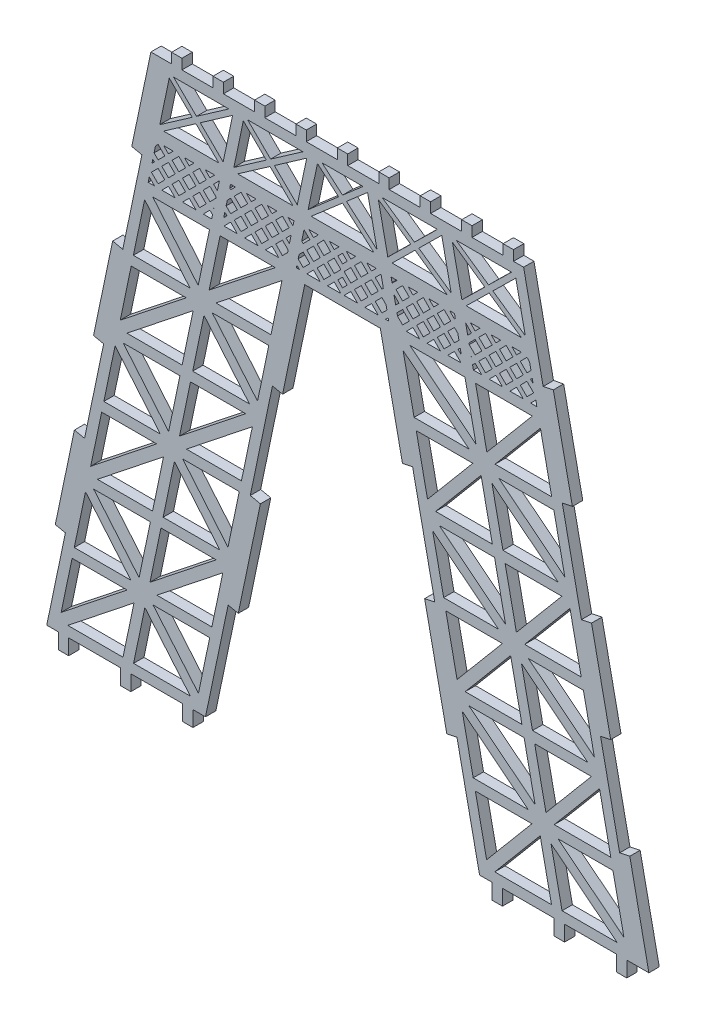
from build123d import *

# Parameters (mm, degrees)
BOSS_EXTRUDE1_DEPTH = 3


with BuildPart() as part:
    # Sketch1 → Boss-Extrude1 (new body)
    with BuildSketch(Plane.XY):
        Polygon((471.399547202, 122.11303907), (471.399547202, 117.61303907), (468.399547202, 117.61303907), (468.399547202, 122.11303907), (453.399547202, 122.11303907), (453.399547202, 117.61303907), (450.399547202, 117.61303907), (450.399547202, 122.11303907), (435.399547202, 122.11303907), (435.399547202, 117.61303907), (432.399547202, 117.61303907), (432.399547202, 122.11303907), (428.773422996, 122.11303907), (422.226309085, 153.416301309), (419.289848237, 152.802137088), (412.87118749, 183.491235105), (415.807648338, 184.105399326), (409.388987592, 214.794497344), (406.452526744, 214.180333123), (400.033865997, 244.86943114), (378.15395516, 244.86943114), (371.735294414, 214.180333123), (368.798833566, 214.794497344), (362.38017282, 184.105399326), (365.316633667, 183.491235105), (358.897972921, 152.802137088), (355.961512073, 153.416301309), (349.414398161, 122.11303907), (345.788273956, 122.11303907), (345.788273956, 117.61303907), (342.788273956, 117.61303907), (342.788273956, 122.11303907), (327.788273956, 122.11303907), (327.788273956, 117.61303907), (324.788273956, 117.61303907), (324.788273956, 122.11303907), (309.788273956, 122.11303907), (309.788273956, 117.61303907), (306.788273956, 117.61303907), (306.788273956, 122.11303907), (303.440687969, 122.11303907), (308.848590908, 147.969470794), (305.91213006, 148.583635015), (311.448486164, 175.05423096), (314.384947011, 174.440066739), (319.921303115, 200.910662683), (316.984842267, 201.524826904), (322.521198371, 227.995422849), (325.457659219, 227.381258628), (330.994015323, 253.851854573), (328.057554475, 254.466018794), (333.593910579, 280.936614739), (339.593910579, 280.936614739), (339.593910579, 283.86943114), (342.593910579, 283.86943114), (342.593910579, 280.936614739), (351.593910579, 280.936614739), (351.593910579, 283.86943114), (354.593910579, 283.86943114), (354.593910579, 280.936614739), (363.593910579, 280.936614739), (363.593910579, 283.86943114), (366.593910579, 283.86943114), (366.593910579, 280.936614739), (375.593910579, 280.936614739), (375.593910579, 283.86943114), (378.593910579, 283.86943114), (378.593910579, 280.936614739), (387.593910579, 280.936614739), (387.593910579, 283.86943114), (390.593910579, 283.86943114), (390.593910579, 280.936614739), (399.593910579, 280.936614739), (399.593910579, 283.86943114), (402.593910579, 283.86943114), (402.593910579, 280.936614739), (411.593910579, 280.936614739), (411.593910579, 283.86943114), (414.593910579, 283.86943114), (414.593910579, 280.936614739), (423.593910579, 280.936614739), (423.593910579, 283.86943114), (426.593910579, 283.86943114), (426.593910579, 280.936614739), (435.593910579, 280.936614739), (435.593910579, 283.86943114), (438.593910579, 283.86943114), (438.593910579, 280.936614739), (441.528996566, 280.936614739), (447.193805835, 253.851854573), (450.130266683, 254.466018794), (455.666622786, 227.995422849), (452.730161939, 227.381258628), (458.266518043, 200.910662683), (461.20297889, 201.524826904), (466.739334994, 175.05423096), (463.802874146, 174.440066739), (469.33923025, 147.969470794), (472.275691098, 148.583635015), (477.812047202, 122.11303907), align=None)
        Polygon((350.454551529, 229.664679794), (353.634643058, 244.86943114), (369.611318566, 244.86943114), align=None, mode=Mode.SUBTRACT)
        Polygon((371.543867516, 242.573199091), (368.372473479, 227.410032462), (352.439493887, 227.410032462), align=None, mode=Mode.SUBTRACT)
        Polygon((327.901137804, 224.410032462), (324.729743767, 209.246865833), (343.834117396, 224.410032462), align=None, mode=Mode.SUBTRACT)
        Polygon((326.662292717, 206.950633784), (345.819059754, 222.15538513), (342.638968225, 206.950633784), align=None, mode=Mode.SUBTRACT)
        Polygon((341.8963372, 188.745882437), (345.076428729, 203.950633784), (361.053104237, 203.950633784), align=None, mode=Mode.SUBTRACT)
        Polygon((362.985653187, 201.654401734), (359.814259151, 186.491235105), (343.881279558, 186.491235105), align=None, mode=Mode.SUBTRACT)
        Polygon((319.342923475, 183.491235105), (316.171529438, 168.328068476), (335.275903067, 183.491235105), align=None, mode=Mode.SUBTRACT)
        Polygon((318.104078389, 166.031836427), (337.260845425, 181.236587773), (334.080753896, 166.031836427), align=None, mode=Mode.SUBTRACT)
        Polygon((333.338122872, 147.827085081), (336.5182144, 163.031836427), (352.494889908, 163.031836427), align=None, mode=Mode.SUBTRACT)
        Polygon((354.427438858, 160.735604378), (351.256044822, 145.572437748), (335.32306523, 145.572437748), align=None, mode=Mode.SUBTRACT)
        Polygon((310.784709146, 142.572437748), (307.61331511, 127.409271119), (326.717688738, 142.572437748), align=None, mode=Mode.SUBTRACT)
        Polygon((309.54586406, 125.11303907), (328.702631096, 140.317790416), (325.522539568, 125.11303907), align=None, mode=Mode.SUBTRACT)
        Polygon((345.01639696, 125.11303907), (328.587453581, 125.11303907), (331.857567168, 140.748206652), align=None, mode=Mode.SUBTRACT)
        Polygon((347.367175217, 126.978854884), (350.628591313, 142.572437748), (334.243343849, 142.572437748), align=None, mode=Mode.SUBTRACT)
        Polygon((317.024357008, 163.031836427), (333.453300387, 163.031836427), (330.1831868, 147.396668845), align=None, mode=Mode.SUBTRACT)
        Polygon((314.673578751, 161.166020613), (311.412162655, 145.572437748), (327.797410119, 145.572437748), align=None, mode=Mode.SUBTRACT)
        Polygon((353.574611288, 166.031836427), (337.145667909, 166.031836427), (340.415781497, 181.667004008), align=None, mode=Mode.SUBTRACT)
        Polygon((355.925389546, 167.897652241), (342.801558178, 183.491235105), (359.186805642, 183.491235105), align=None, mode=Mode.SUBTRACT)
        Polygon((325.582571337, 203.950633784), (342.011514716, 203.950633784), (338.741401129, 188.315466202), align=None, mode=Mode.SUBTRACT)
        Polygon((323.231793079, 202.08481797), (319.970376984, 186.491235105), (336.355624447, 186.491235105), align=None, mode=Mode.SUBTRACT)
        Polygon((362.132825617, 206.950633784), (345.703882238, 206.950633784), (348.973995826, 222.585801365), align=None, mode=Mode.SUBTRACT)
        Polygon((364.483603875, 208.816449598), (351.359772507, 224.410032462), (367.74501997, 224.410032462), align=None, mode=Mode.SUBTRACT)
        Polygon((334.140785666, 244.86943114), (350.569729045, 244.86943114), (347.299615457, 229.234263559), align=None, mode=Mode.SUBTRACT)
        Polygon((331.790007408, 243.003615326), (328.528591313, 227.410032462), (344.913838776, 227.410032462), align=None, mode=Mode.SUBTRACT)
        Polygon((347.892471052, 270.337812889), (357.261962632, 276.866544031), (354.530979123, 263.809081747), align=None, mode=Mode.SUBTRACT)
        Polygon((338.9138076, 277.06414773), (345.552315671, 270.535416588), (336.18282409, 264.006685446), align=None, mode=Mode.SUBTRACT)
        Polygon((353.278887083, 262.936614739), (337.270887433, 262.936614739), (346.640379013, 269.465345881), align=None, mode=Mode.SUBTRACT)
        Polygon((340.16589964, 277.936614739), (356.17389929, 277.936614739), (346.80440771, 271.407883597), align=None, mode=Mode.SUBTRACT)
        Polygon((367.00671376, 270.535416588), (357.63722218, 264.006685446), (360.36820569, 277.06414773), align=None, mode=Mode.SUBTRACT)
        Polygon((374.733285173, 262.936614739), (358.725285523, 262.936614739), (368.094777103, 269.465345881), align=None, mode=Mode.SUBTRACT)
        Polygon((369.346869142, 270.337812889), (378.716360722, 276.866544031), (375.985377212, 263.809081747), align=None, mode=Mode.SUBTRACT)
        Polygon((361.620297729, 277.936614739), (377.62829738, 277.936614739), (368.2588058, 271.407883597), align=None, mode=Mode.SUBTRACT)
        Polygon((387.948477617, 271.795529376), (379.121277983, 264.148485817), (381.829377401, 277.096533979), align=None, mode=Mode.SUBTRACT)
        Polygon((379.315024438, 259.306374211), (382.067590235, 259.306374211), (380.691307336, 257.930091312), align=None, mode=Mode.SUBTRACT)
        Polygon((386.691307336, 257.930091312), (385.315024438, 259.306374211), (388.067590235, 259.306374211), align=None, mode=Mode.SUBTRACT)
        Polygon((386.691307336, 255.808770969), (388.630647165, 253.86943114), (386.691307336, 251.930091312), (384.751967508, 253.86943114), align=None, mode=Mode.SUBTRACT)
        Polygon((385.630647165, 256.86943114), (383.691307336, 254.930091312), (381.751967508, 256.86943114), (383.691307336, 258.808770969), align=None, mode=Mode.SUBTRACT)
        Polygon((384.751967508, 247.86943114), (386.691307336, 249.808770969), (388.630647165, 247.86943114), align=None, mode=Mode.SUBTRACT)
        Polygon((381.751967508, 250.86943114), (383.691307336, 252.808770969), (385.630647165, 250.86943114), (383.691307336, 248.930091312), align=None, mode=Mode.SUBTRACT)
        Polygon((378.751967508, 253.86943114), (380.691307336, 255.808770969), (382.630647165, 253.86943114), (380.691307336, 251.930091312), align=None, mode=Mode.SUBTRACT)
        Polygon((373.315024438, 259.306374211), (375.043630664, 259.306374211), (374.772830059, 258.011614035), (374.691307336, 257.930091312), align=None, mode=Mode.SUBTRACT)
        Polygon((377.279392467, 255.342006182), (377.950301454, 258.549776851), (379.630647165, 256.86943114), (377.691307336, 254.930091312), align=None, mode=Mode.SUBTRACT)
        Polygon((376.630647165, 247.86943114), (375.716494657, 247.86943114), (375.874618861, 248.625459444), align=None, mode=Mode.SUBTRACT)
        Polygon((378.751967508, 247.86943114), (380.691307336, 249.808770969), (382.630647165, 247.86943114), align=None, mode=Mode.SUBTRACT)
        Polygon((376.24155117, 250.379847479), (376.500505831, 251.617969464), (377.691307336, 252.808770969), (379.630647165, 250.86943114), (377.691307336, 248.930091312), align=None, mode=Mode.SUBTRACT)
        Polygon((372.751967508, 253.86943114), (374.211816862, 255.329280494), (373.706786213, 252.914612436), align=None, mode=Mode.SUBTRACT)
        Polygon((369.751967508, 256.86943114), (371.691307336, 258.808770969), (373.630647165, 256.86943114), (371.691307336, 254.930091312), align=None, mode=Mode.SUBTRACT)
        Polygon((367.315024438, 259.306374211), (370.067590235, 259.306374211), (368.691307336, 257.930091312), align=None, mode=Mode.SUBTRACT)
        Polygon((369.751967508, 250.86943114), (371.691307337, 252.808770969), (373.339853904, 251.160224402), (373.186045114, 250.42482909), (371.691307336, 248.930091312), align=None, mode=Mode.SUBTRACT)
        Polygon((366.751967508, 253.86943114), (368.691307336, 255.808770969), (370.630647165, 253.86943114), (368.691307336, 251.930091312), align=None, mode=Mode.SUBTRACT)
        Polygon((363.751967508, 256.86943114), (365.691307336, 258.808770969), (367.630647165, 256.86943114), (365.691307336, 254.930091312), align=None, mode=Mode.SUBTRACT)
        Polygon((361.315024438, 259.306374211), (364.067590235, 259.306374211), (362.691307336, 257.930091312), align=None, mode=Mode.SUBTRACT)
        Polygon((366.751967508, 247.86943114), (368.691307336, 249.808770969), (370.630647165, 247.86943114), align=None, mode=Mode.SUBTRACT)
        Polygon((363.751967508, 250.86943114), (365.691307336, 252.808770969), (367.630647165, 250.86943114), (365.691307336, 248.930091312), align=None, mode=Mode.SUBTRACT)
        Polygon((360.751967508, 253.86943114), (362.691307336, 255.808770969), (364.630647165, 253.86943114), (362.691307336, 251.930091312), align=None, mode=Mode.SUBTRACT)
        Polygon((357.751967508, 256.86943114), (359.691307336, 258.808770969), (361.630647165, 256.86943114), (359.691307336, 254.930091312), align=None, mode=Mode.SUBTRACT)
        Polygon((356.422513876, 258.198884773), (356.654146588, 259.306374211), (358.067590235, 259.306374211), (356.691307337, 257.930091312), align=None, mode=Mode.SUBTRACT)
        Polygon((355.630647165, 250.86943114), (354.693556459, 249.932340434), (355.01774027, 251.482338035), align=None, mode=Mode.SUBTRACT)
        Polygon((360.751967508, 247.86943114), (362.691307336, 249.808770969), (364.630647165, 247.86943114), align=None, mode=Mode.SUBTRACT)
        Polygon((357.751967508, 250.86943114), (359.691307336, 252.808770969), (361.630647165, 250.86943114), (359.691307336, 248.930091312), align=None, mode=Mode.SUBTRACT)
        Polygon((355.384672579, 253.236726069), (355.719328206, 254.836791839), (356.691307336, 255.808770969), (358.630647165, 253.86943114), (356.691307336, 251.930091312), align=None, mode=Mode.SUBTRACT)
        Polygon((351.751967508, 256.86943114), (353.430639237, 258.548102869), (352.849907622, 255.771491027), align=None, mode=Mode.SUBTRACT)
        Polygon((349.315024438, 259.306374211), (352.067590235, 259.306374211), (350.691307336, 257.930091312), align=None, mode=Mode.SUBTRACT)
        Polygon((354.751967508, 247.86943114), (356.691307336, 249.808770969), (358.630647165, 247.86943114), align=None, mode=Mode.SUBTRACT)
        Polygon((351.751967508, 250.86943114), (351.843854291, 250.961317923), (351.812066325, 250.809332323), align=None, mode=Mode.SUBTRACT)
        Polygon((348.751967508, 253.86943114), (350.691307337, 255.808770969), (352.482975313, 254.017102992), (352.404867489, 253.643651464), (350.691307336, 251.930091312), align=None, mode=Mode.SUBTRACT)
        Polygon((345.751967508, 256.86943114), (347.691307336, 258.808770969), (349.630647165, 256.86943114), (347.691307336, 254.930091312), align=None, mode=Mode.SUBTRACT)
        Polygon((343.315024438, 259.306374211), (346.067590235, 259.306374211), (344.691307336, 257.930091312), align=None, mode=Mode.SUBTRACT)
        Polygon((348.751967508, 247.86943114), (350.691307336, 249.808770969), (351.445134016, 249.054944289), (351.197182554, 247.86943114), align=None, mode=Mode.SUBTRACT)
        Polygon((345.751967508, 250.86943114), (347.691307336, 252.808770969), (349.630647165, 250.86943114), (347.691307336, 248.930091312), align=None, mode=Mode.SUBTRACT)
        Polygon((342.751967508, 253.86943114), (344.691307336, 255.808770969), (346.630647165, 253.86943114), (344.691307336, 251.930091312), align=None, mode=Mode.SUBTRACT)
        Polygon((339.751967508, 256.86943114), (341.691307336, 258.808770969), (343.630647165, 256.86943114), (341.691307336, 254.930091312), align=None, mode=Mode.SUBTRACT)
        Polygon((337.315024438, 259.306374211), (340.067590235, 259.306374211), (338.691307336, 257.930091312), align=None, mode=Mode.SUBTRACT)
        Polygon((342.751967508, 247.86943114), (344.691307336, 249.808770969), (346.630647165, 247.86943114), align=None, mode=Mode.SUBTRACT)
        Polygon((339.751967508, 250.86943114), (341.691307336, 252.808770969), (343.630647165, 250.86943114), (341.691307336, 248.930091312), align=None, mode=Mode.SUBTRACT)
        Polygon((336.751967508, 253.86943114), (338.691307336, 255.808770969), (340.630647165, 253.86943114), (338.691307336, 251.930091312), align=None, mode=Mode.SUBTRACT)
        Polygon((334.527793988, 256.09360466), (334.938150581, 258.055614213), (335.691307336, 258.808770969), (337.630647165, 256.86943114), (335.691307336, 254.930091312), align=None, mode=Mode.SUBTRACT)
        Polygon((334.160861679, 254.339216626), (334.630647165, 253.86943114), (333.912378834, 253.151162809), align=None, mode=Mode.SUBTRACT)
        Polygon((336.751967508, 247.86943114), (338.691307337, 249.808770969), (340.630647165, 247.86943114), align=None, mode=Mode.SUBTRACT)
        Polygon((333.751967508, 250.86943114), (335.691307336, 252.808770969), (337.630647165, 250.86943114), (335.691307336, 248.930091312), align=None, mode=Mode.SUBTRACT)
        Polygon((332.807698477, 247.86943114), (334.630647165, 247.86943114), (333.123020382, 249.377057923), align=None, mode=Mode.SUBTRACT)
        Polygon((427.733269629, 229.664679794), (424.5531781, 244.86943114), (408.576502592, 244.86943114), align=None, mode=Mode.SUBTRACT)
        Polygon((425.748327271, 227.410032462), (409.815347678, 227.410032462), (406.643953642, 242.573199091), align=None, mode=Mode.SUBTRACT)
        Polygon((434.353703762, 224.410032462), (453.45807739, 209.246865833), (450.286683354, 224.410032462), align=None, mode=Mode.SUBTRACT)
        Polygon((451.52552844, 206.950633784), (432.368761404, 222.15538513), (435.548852932, 206.950633784), align=None, mode=Mode.SUBTRACT)
        Polygon((436.291483957, 188.745882437), (433.111392429, 203.950633784), (417.134716921, 203.950633784), align=None, mode=Mode.SUBTRACT)
        Polygon((434.306541599, 186.491235105), (418.373562007, 186.491235105), (415.202167971, 201.654401734), align=None, mode=Mode.SUBTRACT)
        Polygon((442.911918091, 183.491235105), (462.016291719, 168.328068476), (458.844897683, 183.491235105), align=None, mode=Mode.SUBTRACT)
        Polygon((460.083742769, 166.031836427), (440.926975733, 181.236587773), (444.107067261, 166.031836427), align=None, mode=Mode.SUBTRACT)
        Polygon((444.849698286, 147.827085081), (441.669606757, 163.031836427), (425.69293125, 163.031836427), align=None, mode=Mode.SUBTRACT)
        Polygon((442.864755928, 145.572437748), (426.931776336, 145.572437748), (423.760382299, 160.735604378), align=None, mode=Mode.SUBTRACT)
        Polygon((451.470132419, 142.572437748), (470.574506048, 127.409271119), (467.403112012, 142.572437748), align=None, mode=Mode.SUBTRACT)
        Polygon((468.641957098, 125.11303907), (449.485190061, 140.317790416), (452.66528159, 125.11303907), align=None, mode=Mode.SUBTRACT)
        Polygon((446.330253989, 140.748206652), (449.600367577, 125.11303907), (433.171424198, 125.11303907), align=None, mode=Mode.SUBTRACT)
        Polygon((443.944477308, 142.572437748), (427.559229845, 142.572437748), (430.82064594, 126.978854884), align=None, mode=Mode.SUBTRACT)
        Polygon((461.163464149, 163.031836427), (444.73452077, 163.031836427), (448.004634358, 147.396668845), align=None, mode=Mode.SUBTRACT)
        Polygon((450.390411039, 145.572437748), (466.775658503, 145.572437748), (463.514242407, 161.166020613), align=None, mode=Mode.SUBTRACT)
        Polygon((424.613209869, 166.031836427), (441.042153248, 166.031836427), (437.772039661, 181.667004008), align=None, mode=Mode.SUBTRACT)
        Polygon((422.262431612, 167.897652241), (435.38626298, 183.491235105), (419.001015516, 183.491235105), align=None, mode=Mode.SUBTRACT)
        Polygon((452.60524982, 203.950633784), (436.176306441, 203.950633784), (439.446420029, 188.315466202), align=None, mode=Mode.SUBTRACT)
        Polygon((441.83219671, 186.491235105), (458.217444174, 186.491235105), (454.956028078, 202.08481797), align=None, mode=Mode.SUBTRACT)
        Polygon((416.054995541, 206.950633784), (432.48393892, 206.950633784), (429.213825332, 222.585801365), align=None, mode=Mode.SUBTRACT)
        Polygon((413.704217283, 208.816449598), (426.828048651, 224.410032462), (410.442801187, 224.410032462), align=None, mode=Mode.SUBTRACT)
        Polygon((444.047035492, 244.86943114), (427.618092113, 244.86943114), (430.8882057, 229.234263559), align=None, mode=Mode.SUBTRACT)
        Polygon((433.273982381, 227.410032462), (449.659229845, 227.410032462), (446.397813749, 243.003615326), align=None, mode=Mode.SUBTRACT)
        Polygon((430.295350105, 270.337812889), (420.925858525, 276.866544031), (423.656842035, 263.809081747), align=None, mode=Mode.SUBTRACT)
        Polygon((439.274013558, 277.06414773), (432.635505487, 270.535416588), (442.004997067, 264.006685446), align=None, mode=Mode.SUBTRACT)
        Polygon((424.908934074, 262.936614739), (440.916933725, 262.936614739), (431.547442145, 269.465345881), align=None, mode=Mode.SUBTRACT)
        Polygon((431.383413448, 271.407883597), (422.013921868, 277.936614739), (438.021921518, 277.936614739), align=None, mode=Mode.SUBTRACT)
        Polygon((411.181107397, 270.535416588), (420.550598977, 264.006685446), (417.819615468, 277.06414773), align=None, mode=Mode.SUBTRACT)
        Polygon((403.454535985, 262.936614739), (419.462535635, 262.936614739), (410.093044055, 269.465345881), align=None, mode=Mode.SUBTRACT)
        Polygon((408.840952016, 270.337812889), (399.471460436, 276.866544031), (402.202443945, 263.809081747), align=None, mode=Mode.SUBTRACT)
        Polygon((409.929015358, 271.407883597), (400.559523778, 277.936614739), (416.567523428, 277.936614739), align=None, mode=Mode.SUBTRACT)
        Polygon((390.23934354, 271.795529376), (399.066543174, 264.148485817), (396.358443756, 277.096533979), align=None, mode=Mode.SUBTRACT)
        Polygon((398.87279672, 259.306374211), (396.120230922, 259.306374211), (397.496513821, 257.930091312), align=None, mode=Mode.SUBTRACT)
        Polygon((390.435853649, 250.86943114), (389.093910579, 252.211374211), (387.751967508, 250.86943114), (389.093910579, 249.52748807), align=None, mode=Mode.SUBTRACT)
        Polygon((391.496513821, 257.930091312), (392.87279672, 259.306374211), (390.120230922, 259.306374211), align=None, mode=Mode.SUBTRACT)
        Polygon((391.496513821, 255.808770969), (389.557173993, 253.86943114), (391.496513821, 251.930091312), (393.435853649, 253.86943114), align=None, mode=Mode.SUBTRACT)
        Polygon((392.557173993, 256.86943114), (394.496513821, 254.930091312), (396.435853649, 256.86943114), (394.496513821, 258.808770969), align=None, mode=Mode.SUBTRACT)
        Polygon((393.435853649, 247.86943114), (391.496513821, 249.808770969), (389.557173993, 247.86943114), align=None, mode=Mode.SUBTRACT)
        Polygon((396.435853649, 250.86943114), (394.496513821, 252.808770969), (392.557173993, 250.86943114), (394.496513821, 248.930091312), align=None, mode=Mode.SUBTRACT)
        Polygon((399.435853649, 253.86943114), (397.496513821, 255.808770969), (395.557173993, 253.86943114), (397.496513821, 251.930091312), align=None, mode=Mode.SUBTRACT)
        Polygon((404.87279672, 259.306374211), (403.144190493, 259.306374211), (403.414991099, 258.011614035), (403.496513821, 257.930091312), align=None, mode=Mode.SUBTRACT)
        Polygon((400.908428691, 255.342006182), (400.237519703, 258.549776851), (398.557173993, 256.86943114), (400.496513821, 254.930091312), align=None, mode=Mode.SUBTRACT)
        Polygon((402.313202297, 248.625459444), (402.471326501, 247.86943114), (401.557173993, 247.86943114), align=None, mode=Mode.SUBTRACT)
        Polygon((399.435853649, 247.86943114), (397.496513821, 249.808770969), (395.557173993, 247.86943114), align=None, mode=Mode.SUBTRACT)
        Polygon((401.946269988, 250.379847479), (401.687315326, 251.617969464), (400.496513821, 252.808770969), (398.557173993, 250.86943114), (400.496513821, 248.930091312), align=None, mode=Mode.SUBTRACT)
        Polygon((405.435853649, 253.86943114), (403.976004296, 255.329280494), (404.481034945, 252.914612436), align=None, mode=Mode.SUBTRACT)
        Polygon((408.435853649, 256.86943114), (406.496513821, 258.808770969), (404.557173993, 256.86943114), (406.496513821, 254.930091312), align=None, mode=Mode.SUBTRACT)
        Polygon((410.87279672, 259.306374211), (408.120230922, 259.306374211), (409.496513821, 257.930091312), align=None, mode=Mode.SUBTRACT)
        Polygon((408.435853649, 250.86943114), (406.496513821, 252.808770969), (404.847967254, 251.160224402), (405.001776044, 250.424829089), (406.496513821, 248.930091312), align=None, mode=Mode.SUBTRACT)
        Polygon((411.435853649, 253.86943114), (409.496513821, 255.808770969), (407.557173993, 253.86943114), (409.496513821, 251.930091312), align=None, mode=Mode.SUBTRACT)
        Polygon((414.435853649, 256.86943114), (412.496513821, 258.808770969), (410.557173993, 256.86943114), (412.496513821, 254.930091312), align=None, mode=Mode.SUBTRACT)
        Polygon((416.87279672, 259.306374211), (414.120230922, 259.306374211), (415.496513821, 257.930091312), align=None, mode=Mode.SUBTRACT)
        Polygon((411.435853649, 247.86943114), (409.496513821, 249.808770969), (407.557173993, 247.86943114), align=None, mode=Mode.SUBTRACT)
        Polygon((414.435853649, 250.86943114), (412.496513821, 252.808770969), (410.557173993, 250.86943114), (412.496513821, 248.930091312), align=None, mode=Mode.SUBTRACT)
        Polygon((417.435853649, 253.86943114), (415.496513821, 255.808770969), (413.557173993, 253.86943114), (415.496513821, 251.930091312), align=None, mode=Mode.SUBTRACT)
        Polygon((420.435853649, 256.86943114), (418.496513821, 258.808770969), (416.557173993, 256.86943114), (418.496513821, 254.930091312), align=None, mode=Mode.SUBTRACT)
        Polygon((421.765307282, 258.198884773), (421.53367457, 259.306374211), (420.120230922, 259.306374211), (421.496513821, 257.930091312), align=None, mode=Mode.SUBTRACT)
        Polygon((422.557173993, 250.86943114), (423.494264699, 249.932340434), (423.170080888, 251.482338035), align=None, mode=Mode.SUBTRACT)
        Polygon((417.435853649, 247.86943114), (415.496513821, 249.808770969), (413.557173993, 247.86943114), align=None, mode=Mode.SUBTRACT)
        Polygon((420.435853649, 250.86943114), (418.496513821, 252.808770969), (416.557173993, 250.86943114), (418.496513821, 248.930091312), align=None, mode=Mode.SUBTRACT)
        Polygon((422.803148578, 253.236726069), (422.468492951, 254.836791839), (421.496513821, 255.808770969), (419.557173993, 253.86943114), (421.496513821, 251.930091312), align=None, mode=Mode.SUBTRACT)
        Polygon((426.435853649, 256.86943114), (424.757181921, 258.548102869), (425.337913536, 255.771491027), align=None, mode=Mode.SUBTRACT)
        Polygon((428.87279672, 259.306374211), (426.120230922, 259.306374211), (427.496513821, 257.930091312), align=None, mode=Mode.SUBTRACT)
        Polygon((423.435853649, 247.86943114), (421.496513821, 249.808770969), (419.557173993, 247.86943114), align=None, mode=Mode.SUBTRACT)
        Polygon((426.435853649, 250.86943114), (426.343966867, 250.961317923), (426.375754833, 250.809332323), align=None, mode=Mode.SUBTRACT)
        Polygon((429.435853649, 253.86943114), (427.496513821, 255.808770969), (425.704845845, 254.017102992), (425.782953669, 253.643651464), (427.496513821, 251.930091312), align=None, mode=Mode.SUBTRACT)
        Polygon((432.435853649, 256.86943114), (430.496513821, 258.808770969), (428.557173993, 256.86943114), (430.496513821, 254.930091312), align=None, mode=Mode.SUBTRACT)
        Polygon((434.87279672, 259.306374211), (432.120230922, 259.306374211), (433.496513821, 257.930091312), align=None, mode=Mode.SUBTRACT)
        Polygon((429.435853649, 247.86943114), (427.496513821, 249.808770969), (426.742687142, 249.054944289), (426.990638604, 247.86943114), align=None, mode=Mode.SUBTRACT)
        Polygon((432.435853649, 250.86943114), (430.496513821, 252.808770969), (428.557173993, 250.86943114), (430.496513821, 248.930091312), align=None, mode=Mode.SUBTRACT)
        Polygon((435.435853649, 253.86943114), (433.496513821, 255.808770969), (431.557173993, 253.86943114), (433.496513821, 251.930091312), align=None, mode=Mode.SUBTRACT)
        Polygon((438.435853649, 256.86943114), (436.496513821, 258.808770969), (434.557173993, 256.86943114), (436.496513821, 254.930091312), align=None, mode=Mode.SUBTRACT)
        Polygon((440.87279672, 259.306374211), (438.120230922, 259.306374211), (439.496513821, 257.930091312), align=None, mode=Mode.SUBTRACT)
        Polygon((435.435853649, 247.86943114), (433.496513821, 249.808770969), (431.557173993, 247.86943114), align=None, mode=Mode.SUBTRACT)
        Polygon((438.435853649, 250.86943114), (436.496513821, 252.808770969), (434.557173993, 250.86943114), (436.496513821, 248.930091312), align=None, mode=Mode.SUBTRACT)
        Polygon((441.435853649, 253.86943114), (439.496513821, 255.808770969), (437.557173993, 253.86943114), (439.496513821, 251.930091312), align=None, mode=Mode.SUBTRACT)
        Polygon((442.496513821, 254.930091312), (440.557173993, 256.86943114), (442.496513821, 258.808770969), (443.249670576, 258.055614213), (443.660027169, 256.09360466), align=None, mode=Mode.SUBTRACT)
        Polygon((444.026959479, 254.339216626), (443.557173993, 253.86943114), (444.275442324, 253.151162809), align=None, mode=Mode.SUBTRACT)
        Polygon((441.435853649, 247.86943114), (439.496513821, 249.808770969), (437.557173993, 247.86943114), align=None, mode=Mode.SUBTRACT)
        Polygon((444.435853649, 250.86943114), (442.496513821, 252.808770969), (440.557173993, 250.86943114), (442.496513821, 248.930091312), align=None, mode=Mode.SUBTRACT)
        Polygon((445.064800776, 249.377057923), (443.557173993, 247.86943114), (445.380122681, 247.86943114), align=None, mode=Mode.SUBTRACT)
        Polygon((380.013246691, 262.936614739), (398.174574466, 262.936614739), (389.093910579, 270.803235544), align=None, mode=Mode.SUBTRACT)
        Polygon((389.093910579, 272.787823208), (395.037306921, 277.936614739), (383.150514236, 277.936614739), align=None, mode=Mode.SUBTRACT)
        Polygon((389.093910579, 258.211374211), (390.435853649, 256.86943114), (389.093910579, 255.52748807), (387.751967508, 256.86943114), align=None, mode=Mode.SUBTRACT)
    extrude(amount=BOSS_EXTRUDE1_DEPTH)


solid = part.part
